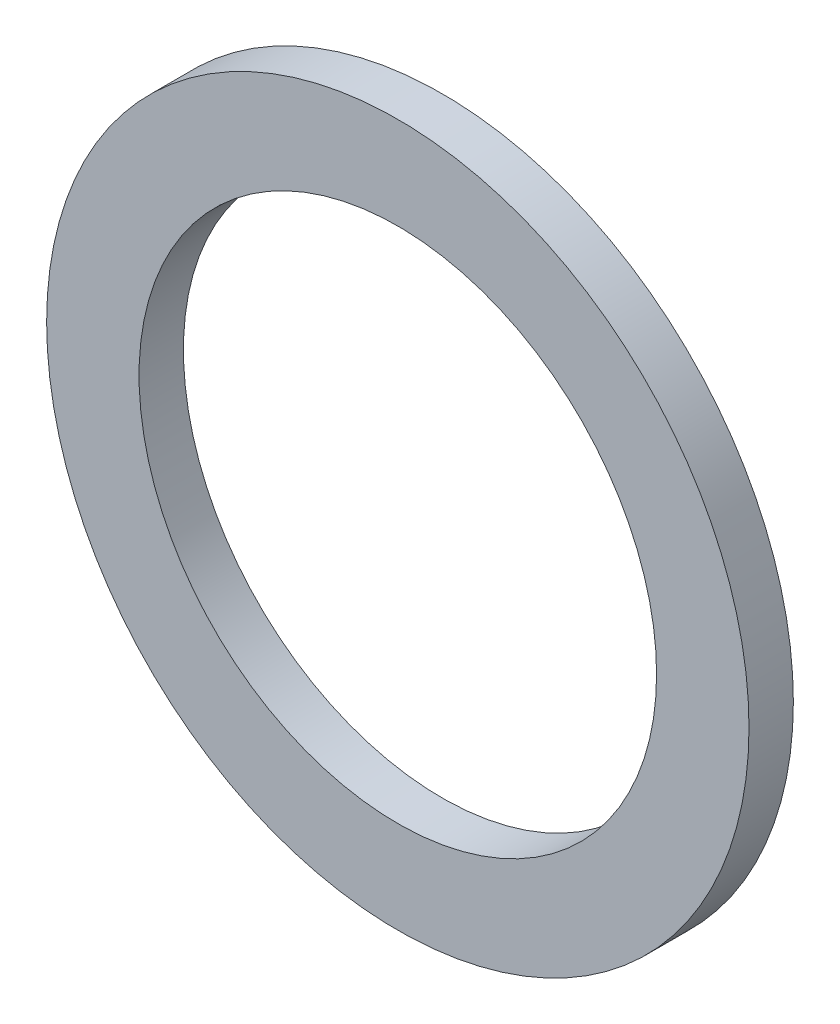
from build123d import *

# Parameters (mm, degrees)
SKETCH_1_R      = 47.5
SKETCH_1_R_2    = 35
EXTRUDE_1_DEPTH = 6


with BuildPart() as part:
    # 草图1 → 凸台-拉伸1 (new body)
    with BuildSketch(Plane.XY):
        Circle(SKETCH_1_R)
        Circle(SKETCH_1_R_2, mode=Mode.SUBTRACT)
    extrude(amount=EXTRUDE_1_DEPTH)


solid = part.part
